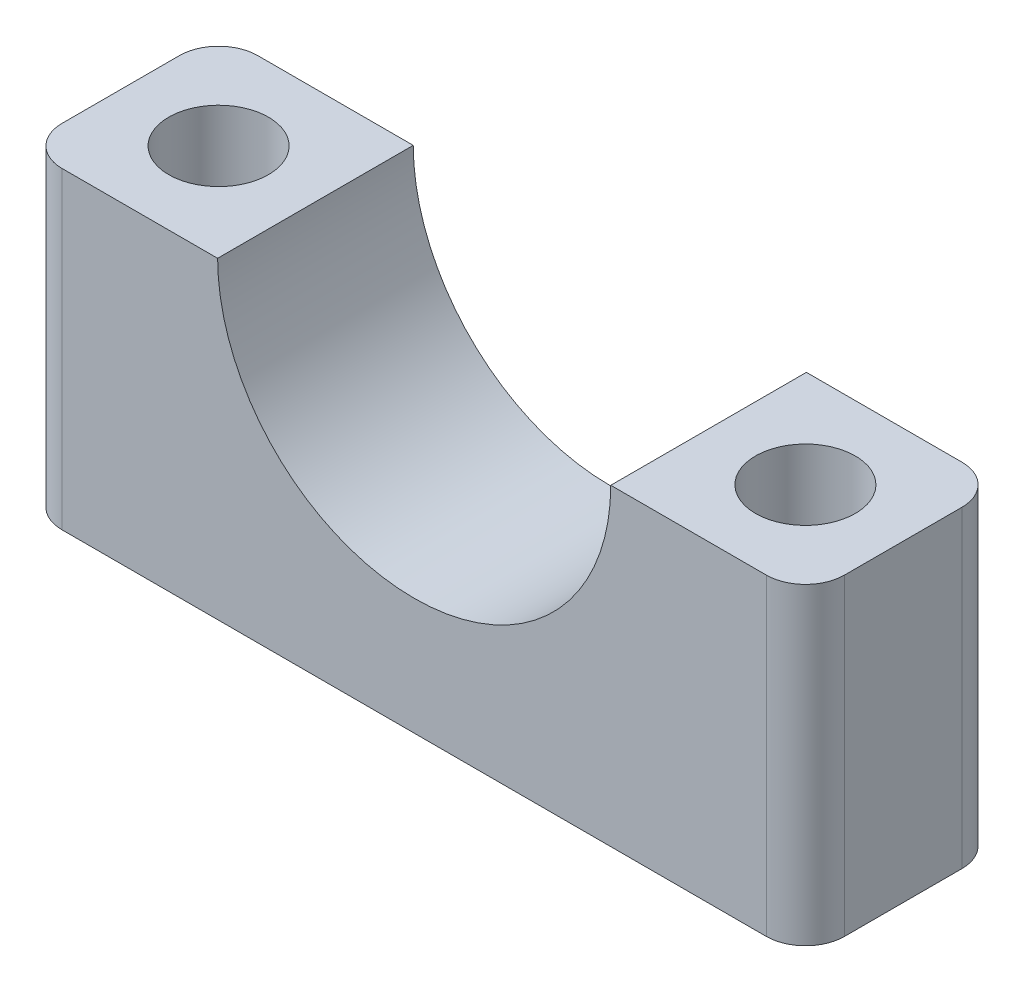
from build123d import *

# Parameters (mm, degrees)
SKETCH1_W           = 40
SKETCH1_H           = 16
BOSS_EXTRUDE1_DEPTH = 10
FILLET1_R           = 2
SKETCH3_R           = 10.05
CUT_EXTRUDE1_DEPTH  = 24.748684174
SKETCH4_R           = 2.55
CUT_EXTRUDE2_DEPTH  = 28.49545417


with BuildPart() as part:
    # Sketch1 → Boss-Extrude1 (new body)
    with BuildSketch(Plane.XY):
        Rectangle(SKETCH1_W, SKETCH1_H)
    extrude(amount=BOSS_EXTRUDE1_DEPTH)

    # Fillet1
    fillet1_edges = [part.edges().sort_by_distance(p)[0] for p in [
        (20, 0, 10),
        (-20, 0, 10),
        (20, 0, 0),
        (-20, 0, 0),
    ]]
    fillet(fillet1_edges, radius=FILLET1_R)

    # Sketch3 → Cut-Extrude1 (cut, through all)
    with BuildSketch(Plane.XY.offset(10)):
        with Locations((0, 8.02)):
            Circle(SKETCH3_R)
    extrude(amount=-CUT_EXTRUDE1_DEPTH, mode=Mode.SUBTRACT)

    # Sketch4 → Cut-Extrude2 (cut, through all)
    with BuildSketch(Plane(origin=(0, 8, 0), x_dir=(1, 0, 0), z_dir=(0, 1, 0))):
        with Locations(Location((-15, -5, 0), (0, 0, 270))):
            Circle(SKETCH4_R)
        with Locations(Location((15, -5, 0), (0, 0, 270))):
            Circle(SKETCH4_R)
    extrude(amount=-CUT_EXTRUDE2_DEPTH, mode=Mode.SUBTRACT)


solid = part.part
